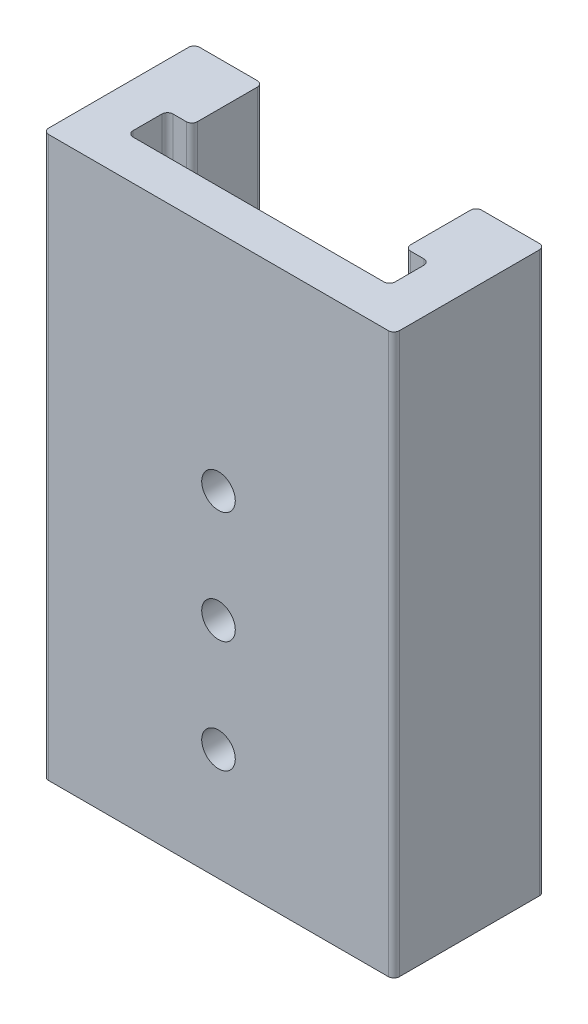
from build123d import *

# Parameters (mm, degrees)
BOSS_EXTRUDE1_DEPTH = 50
CUT_EXTRUDE1_REACH  = 56.109
SKETCH2_R           = 1.5


with BuildPart() as part:
    # Sketch1 → Boss-Extrude1 (new body)
    with BuildSketch(Plane(origin=(0, 0, 0), x_dir=(1, 0, 0), z_dir=(0, 1, 0))):
        with BuildLine():
            Line((-15.1765625, 0), (15.1765625, 0))
            ThreePointArc((15.1765625, 0), (15.530115891, 0.146446609), (15.6765625, 0.5))
            Line((15.6765625, 0.5), (15.6765625, 12.99375))
            ThreePointArc((15.6765625, 12.99375), (15.530115891, 13.347303391), (15.1765625, 13.49375))
            Line((15.1765625, 13.49375), (10.025, 13.49375))
            ThreePointArc((10.025, 13.49375), (9.671446609, 13.347303391), (9.525, 12.99375))
            Line((9.525, 12.99375), (9.525, 7.64375))
            ThreePointArc((9.525, 7.64375), (9.671446609, 7.290196609), (10.025, 7.14375))
            Line((10.025, 7.14375), (11.2078125, 7.14375))
            ThreePointArc((11.2078125, 7.14375), (11.561365891, 6.997303391), (11.7078125, 6.64375))
            Line((11.7078125, 6.64375), (11.7078125, 4.071875))
            ThreePointArc((11.7078125, 4.071875), (11.561365891, 3.718321609), (11.2078125, 3.571875))
            Line((11.2078125, 3.571875), (-11.2078125, 3.571875))
            ThreePointArc((-11.2078125, 3.571875), (-11.561365891, 3.718321609), (-11.7078125, 4.071875))
            Line((-11.7078125, 4.071875), (-11.7078125, 6.64375))
            ThreePointArc((-11.7078125, 6.64375), (-11.561365891, 6.997303391), (-11.2078125, 7.14375))
            Line((-11.2078125, 7.14375), (-10.025, 7.14375))
            ThreePointArc((-10.025, 7.14375), (-9.671446609, 7.290196609), (-9.525, 7.64375))
            Line((-9.525, 7.64375), (-9.525, 12.99375))
            ThreePointArc((-9.525, 12.99375), (-9.671446609, 13.347303391), (-10.025, 13.49375))
            Line((-10.025, 13.49375), (-15.1765625, 13.49375))
            ThreePointArc((-15.1765625, 13.49375), (-15.530115891, 13.347303391), (-15.6765625, 12.99375))
            Line((-15.6765625, 12.99375), (-15.6765625, 0.5))
            ThreePointArc((-15.6765625, 0.5), (-15.530115891, 0.146446609), (-15.1765625, 0))
        make_face()
    extrude(amount=BOSS_EXTRUDE1_DEPTH)

    # Sketch2 → Cut-Extrude1 (cut, up to next)
    with BuildSketch(Plane.XY, mode=Mode.PRIVATE) as cut_extrude1_sk1:
        with Locations((0, 10)):
            Circle(SKETCH2_R)
    cut_extrude1_tool1 = extrude(cut_extrude1_sk1.sketch, amount=-CUT_EXTRUDE1_REACH, mode=Mode.PRIVATE) & part.part
    # Sketch2 → Cut-Extrude1 (cut, up to next)
    with BuildSketch(Plane.XY, mode=Mode.PRIVATE) as cut_extrude1_sk2:
        with Locations((0, 20)):
            Circle(SKETCH2_R)
    cut_extrude1_tool2 = extrude(cut_extrude1_sk2.sketch, amount=-CUT_EXTRUDE1_REACH, mode=Mode.PRIVATE) & part.part
    # Sketch2 → Cut-Extrude1 (cut, up to next)
    with BuildSketch(Plane.XY, mode=Mode.PRIVATE) as cut_extrude1_sk3:
        with Locations((0, 30)):
            Circle(SKETCH2_R)
    cut_extrude1_tool3 = extrude(cut_extrude1_sk3.sketch, amount=-CUT_EXTRUDE1_REACH, mode=Mode.PRIVATE) & part.part
    add(cut_extrude1_tool1.solids().sort_by_distance((0, 10, 0))[0], mode=Mode.SUBTRACT)
    add(cut_extrude1_tool2.solids().sort_by_distance((0, 20, 0))[0], mode=Mode.SUBTRACT)
    add(cut_extrude1_tool3.solids().sort_by_distance((0, 30, 0))[0], mode=Mode.SUBTRACT)


solid = part.part
